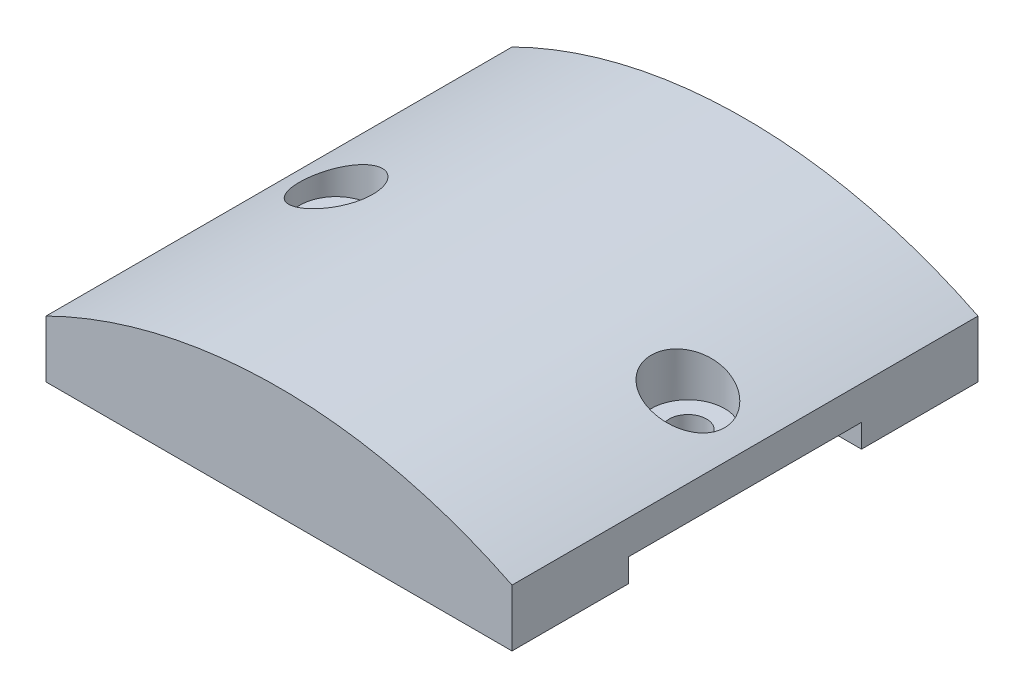
from build123d import *

# Parameters (mm, degrees)
RESSALTO_EXTRUS_O1_DEPTH   = 40
ESBO_O2_R                  = 1.6
CORTE_EXTRUS_O1_DEPTH      = 2
CORTE_EXTRUS_O2_REACH      = 47.069
CORTE_EXTRUS_O2_END_RADIUS = 45
ESBO_O3_R                  = 3.15
ESBO_O4_W                  = 40
ESBO_O4_H                  = 10
RESSALTO_EXTRUS_O2_DEPTH   = 2


with BuildPart() as part:
    # Esboço1 → Ressalto-extrusão1 (new body)
    with BuildSketch(Plane.XY):
        with BuildLine():
            Line((-20, 40.311288741), (-20, 37.411288741))
            Line((-20, 37.411288741), (20, 37.411288741))
            Line((20, 37.411288741), (20, 40.311288741))
            ThreePointArc((20, 40.311288741), (0, 45), (-20, 40.311288741))
        make_face()
    extrude(amount=RESSALTO_EXTRUS_O1_DEPTH)

    # Esboço2 → Corte-extrusão1 (cut)
    with BuildSketch(Plane.XZ.offset(-37.411288741)):
        with Locations(Location((15.1, 20, 0), (0, 0, 270))):
            Circle(ESBO_O2_R)
        with Locations(Location((-15.1, 20, 0), (0, 0, 270))):
            Circle(ESBO_O2_R)
    extrude(amount=-CORTE_EXTRUS_O1_DEPTH, mode=Mode.SUBTRACT)

    # Corte-extrusão2: up to this cylinder (the profile starts inside it)
    corte_extrus_o2_end = Plane(origin=(0, 0, 20), z_dir=(0, 0, -1)) * Cylinder(CORTE_EXTRUS_O2_END_RADIUS, 185.138, mode=Mode.PRIVATE)
    # Esboço3 → Corte-extrusão2 (cut, up to the surface)
    with BuildSketch(Plane.XZ.offset(-39.411288741), mode=Mode.PRIVATE) as corte_extrus_o2_sk1:
        with Locations(Location((15.1, 20, 0), (0, 0, 270))):
            Circle(ESBO_O3_R)
    corte_extrus_o2_tool1 = extrude(corte_extrus_o2_sk1.sketch, amount=-CORTE_EXTRUS_O2_REACH, mode=Mode.PRIVATE) & corte_extrus_o2_end
    add(corte_extrus_o2_tool1.solids().sort_by_distance((15.1, 39.411289, 20))[0], mode=Mode.SUBTRACT)
    # Esboço3 → Corte-extrusão2 (cut, up to the surface)
    with BuildSketch(Plane.XZ.offset(-39.411288741), mode=Mode.PRIVATE) as corte_extrus_o2_sk2:
        with Locations(Location((-15.1, 20, 0), (0, 0, 270))):
            Circle(ESBO_O3_R)
    corte_extrus_o2_tool2 = extrude(corte_extrus_o2_sk2.sketch, amount=-CORTE_EXTRUS_O2_REACH, mode=Mode.PRIVATE) & corte_extrus_o2_end
    add(corte_extrus_o2_tool2.solids().sort_by_distance((-15.1, 39.411289, 20))[0], mode=Mode.SUBTRACT)

    # Esboço4 → Ressalto-extrusão2 (add)
    with BuildSketch(Plane.XZ.offset(-37.411288741)):
        with Locations((0, 35)):
            Rectangle(ESBO_O4_W, ESBO_O4_H)
        with Locations((0, 5)):
            Rectangle(ESBO_O4_W, ESBO_O4_H)
    extrude(amount=RESSALTO_EXTRUS_O2_DEPTH)


solid = part.part
